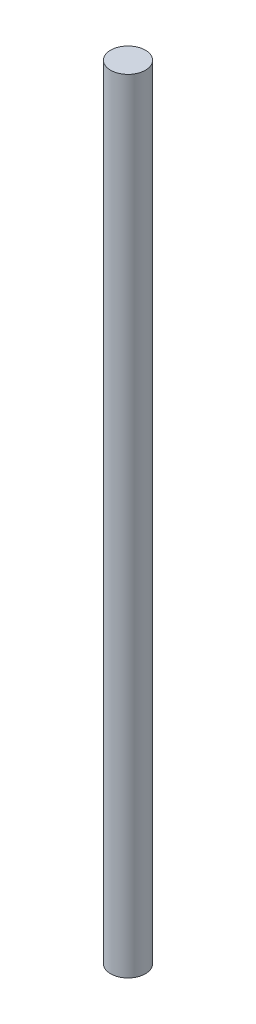
from build123d import *

# Parameters (mm, degrees)
SKETCH1_R           = 2
BOSS_EXTRUDE1_DEPTH = 90


with BuildPart() as part:
    # Sketch1 → Boss-Extrude1 (new body)
    with BuildSketch(Plane(origin=(0, 0, 0), x_dir=(1, 0, 0), z_dir=(0, 1, 0))):
        with Locations(Location((0, 0, 0), (0, 0, 90))):
            Circle(SKETCH1_R)
    extrude(amount=BOSS_EXTRUDE1_DEPTH)


solid = part.part
